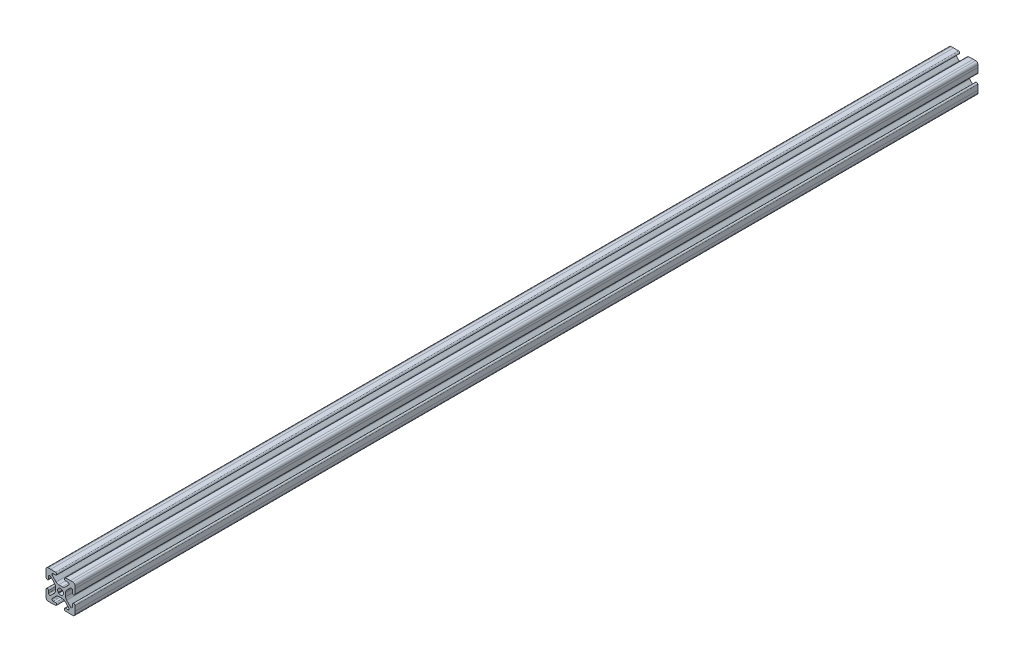
from build123d import *

# Parameters (mm, degrees)
BOSS_EXTRUDE1_DEPTH = 777.3416


with BuildPart() as part:
    # Model → Boss-Extrude1 (new body)
    with BuildSketch(Plane.XY):
        with BuildLine():
            Line((50.659960212, 72.999871414), (53.774553856, 72.999871414))
            ThreePointArc((53.774553856, 72.999871414), (54.989573754, 72.758188929), (56.019617887, 72.069935444))
            Line((56.019617887, 72.069935444), (59.264200891, 68.825352439))
            ThreePointArc((59.264200891, 68.825352439), (59.477513437, 67.701802895), (58.510322513, 67.091550869))
            Line((58.510322513, 67.091550869), (56.572487817, 67.159221548))
            ThreePointArc((56.572487817, 67.159221548), (55.4691069, 66.130302197), (56.498026251, 65.026921279))
            Line((56.498026251, 65.026921279), (60.677257034, 64.880979325))
            Line((60.677257034, 64.880979325), (62.710657034, 64.880979325))
            ThreePointArc((62.710657034, 64.880979325), (64.129537501, 65.468698857), (64.717257034, 66.887579325))
            Line((64.717257034, 66.887579325), (64.717257034, 68.920979325))
            Line((64.717257034, 68.920979325), (64.57131508, 73.100210108))
            ThreePointArc((64.57131508, 73.100210108), (63.467934162, 74.129129459), (62.439014811, 73.025748542))
            Line((62.439014811, 73.025748542), (62.50668549, 71.087913846))
            ThreePointArc((62.50668549, 71.087913846), (61.896433464, 70.120722922), (60.77288392, 70.334035468))
            Line((60.77288392, 70.334035468), (57.528300915, 73.578618472))
            ThreePointArc((57.528300915, 73.578618472), (56.84004743, 74.608662605), (56.598364945, 75.823682503))
            Line((56.598364945, 75.823682503), (56.598364945, 78.938276147))
            ThreePointArc((56.598364945, 78.938276147), (56.84004743, 80.153296044), (57.528300915, 81.183340177))
            Line((57.528300915, 81.183340177), (60.77288392, 84.427923182))
            ThreePointArc((60.77288392, 84.427923182), (61.896433464, 84.641235728), (62.50668549, 83.674044803))
            Line((62.50668549, 83.674044803), (62.439014811, 81.736210108))
            ThreePointArc((62.439014811, 81.736210108), (63.467934162, 80.63282919), (64.57131508, 81.661748542))
            Line((64.57131508, 81.661748542), (64.717257034, 85.840979325))
            Line((64.717257034, 85.840979325), (64.717257034, 87.874379325))
            ThreePointArc((64.717257034, 87.874379325), (64.129537501, 89.293259792), (62.710657034, 89.880979325))
            Line((62.710657034, 89.880979325), (60.677257034, 89.880979325))
            Line((60.677257034, 89.880979325), (56.498026251, 89.73503737))
            ThreePointArc((56.498026251, 89.73503737), (55.4691069, 88.631656452), (56.572487817, 87.602737101))
            Line((56.572487817, 87.602737101), (58.510322513, 87.67040778))
            ThreePointArc((58.510322513, 87.67040778), (59.477513437, 87.060155754), (59.264200891, 85.93660621))
            Line((59.264200891, 85.93660621), (56.019617887, 82.692023205))
            ThreePointArc((56.019617887, 82.692023205), (54.989573754, 82.00376972), (53.774553856, 81.762087236))
            Line((53.774553856, 81.762087236), (50.659960212, 81.762087236))
            ThreePointArc((50.659960212, 81.762087236), (49.444940315, 82.00376972), (48.414896182, 82.692023205))
            Line((48.414896182, 82.692023205), (45.170313177, 85.93660621))
            ThreePointArc((45.170313177, 85.93660621), (44.957000631, 87.060155754), (45.924191556, 87.67040778))
            Line((45.924191556, 87.67040778), (47.862026251, 87.602737101))
            ThreePointArc((47.862026251, 87.602737101), (48.965407169, 88.631656452), (47.936487817, 89.73503737))
            Line((47.936487817, 89.73503737), (43.757257034, 89.880979325))
            Line((43.757257034, 89.880979325), (41.723857034, 89.880979325))
            ThreePointArc((41.723857034, 89.880979325), (40.304976567, 89.293259792), (39.717257034, 87.874379325))
            Line((39.717257034, 87.874379325), (39.717257034, 85.840979325))
            Line((39.717257034, 85.840979325), (39.863198989, 81.661748542))
            ThreePointArc((39.863198989, 81.661748542), (40.966579907, 80.63282919), (41.995499258, 81.736210108))
            Line((41.995499258, 81.736210108), (41.927828579, 83.674044803))
            ThreePointArc((41.927828579, 83.674044803), (42.538080605, 84.641235728), (43.661630149, 84.427923182))
            Line((43.661630149, 84.427923182), (46.906213154, 81.183340177))
            ThreePointArc((46.906213154, 81.183340177), (47.594466639, 80.153296044), (47.836149123, 78.938276147))
            Line((47.836149123, 78.938276147), (47.836149123, 75.823682503))
            ThreePointArc((47.836149123, 75.823682503), (47.594466639, 74.608662605), (46.906213154, 73.578618472))
            Line((46.906213154, 73.578618472), (43.661630149, 70.334035468))
            ThreePointArc((43.661630149, 70.334035468), (42.538080605, 70.120722922), (41.927828579, 71.087913846))
            Line((41.927828579, 71.087913846), (41.995499258, 73.025748542))
            ThreePointArc((41.995499258, 73.025748542), (40.966579907, 74.129129459), (39.863198989, 73.100210108))
            Line((39.863198989, 73.100210108), (39.717257034, 68.920979325))
            Line((39.717257034, 68.920979325), (39.717257034, 66.887579325))
            ThreePointArc((39.717257034, 66.887579325), (40.304976567, 65.468698857), (41.723857034, 64.880979325))
            Line((41.723857034, 64.880979325), (43.757257034, 64.880979325))
            Line((43.757257034, 64.880979325), (47.936487817, 65.026921279))
            ThreePointArc((47.936487817, 65.026921279), (48.965407169, 66.130302197), (47.862026251, 67.159221548))
            Line((47.862026251, 67.159221548), (45.924191556, 67.091550869))
            ThreePointArc((45.924191556, 67.091550869), (44.957000631, 67.701802895), (45.170313177, 68.825352439))
            Line((45.170313177, 68.825352439), (48.414896182, 72.069935444))
            ThreePointArc((48.414896182, 72.069935444), (49.444940315, 72.758188929), (50.659960212, 72.999871414))
        make_face()
        with BuildLine():
            Line((50.64953831, 75.433607249), (50.269884959, 75.433607249))
            Line((50.269884959, 75.433607249), (50.269884959, 75.8132606))
            ThreePointArc((50.269884959, 75.8132606), (53.985023987, 79.148746278), (50.64953831, 75.433607249))
        make_face(mode=Mode.SUBTRACT)
    extrude(amount=BOSS_EXTRUDE1_DEPTH)


solid = part.part
